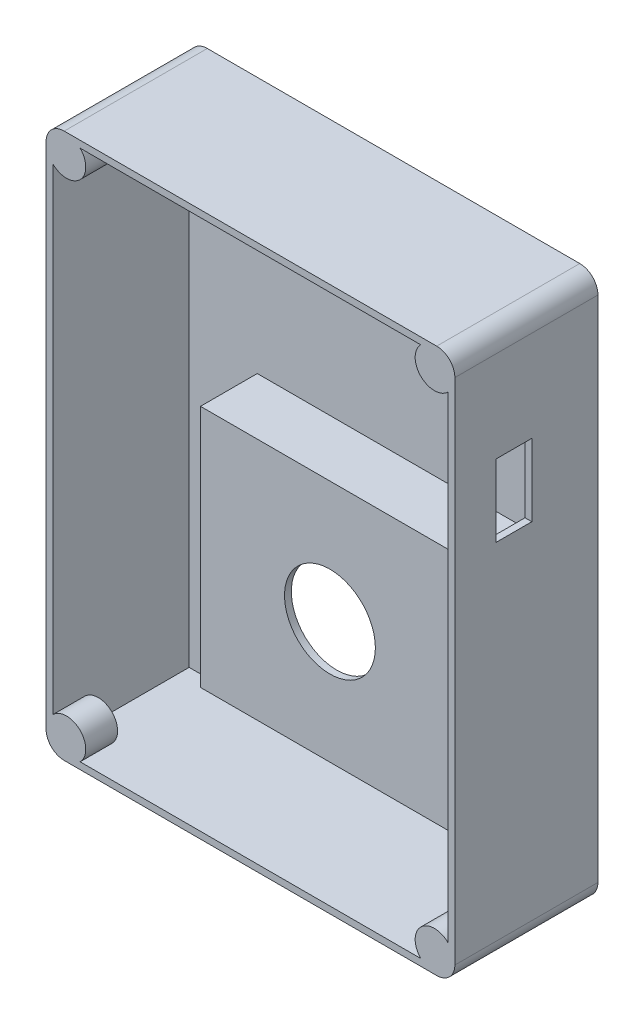
from build123d import *

# Parameters (mm, degrees)
SKETCH2_W               = 90
SKETCH2_H               = 120
BOSS_EXTRUDE1_DEPTH     = 31.5
SKETCH4_W               = 87
SKETCH4_H               = 117
CUT_EXTRUDE1_DEPTH      = 30
FILLET4_R               = 4
SKETCH18_W              = 57
SKETCH18_H              = 53.6
KHAY_PIN_DEPTH          = 12.5
SKETCH21_W              = 53
SKETCH21_H              = 49.6
BOSS_EXTRUDE11_DEPTH    = 15
SKETCH22_W              = 53
SKETCH22_H              = 49.6
CUT_EXTRUDE4_DEPTH      = 13.5
SKETCH30_W              = 7
SKETCH30_H              = 14
CUT_EXTRUDE8_DEPTH      = 5
SKETCH34_R              = 4.242640687
BOSS_EXTRUDE12_DEPTH    = 7
SKETCH37_W              = 7.9
SKETCH37_H              = 15.9
CUT_EXTRUDE10_DEPTH     = 5
MIRROR2_COPY_1_SKETCH_R = 4.242640687
MIRROR2_COPY_1_DEPTH    = 7
SKETCH38_R              = 10
CUT_EXTRUDE11_DEPTH     = 10


with BuildPart() as part:
    # Sketch2 → Boss-Extrude1 (new body)
    with BuildSketch(Plane.XY):
        Rectangle(SKETCH2_W, SKETCH2_H)
    extrude(amount=BOSS_EXTRUDE1_DEPTH)

    # Sketch4 → Cut-Extrude1 (cut)
    with BuildSketch(Plane.XY.offset(31.5)):
        Rectangle(SKETCH4_W, SKETCH4_H)
    extrude(amount=-CUT_EXTRUDE1_DEPTH, mode=Mode.SUBTRACT)

    # Fillet4
    fillet4_edges = [part.edges().sort_by_distance(p)[0] for p in [
        (45, -60, 15.75),
        (-45, -60, 15.75),
        (-45, 60, 15.75),
        (45, 60, 15.75),
    ]]
    fillet(fillet4_edges, radius=FILLET4_R)

    # Sketch18 → khay_pin (add)
    with BuildSketch(Plane.XY.offset(1.5)):
        with Locations((0, -21.775547075)):
            Rectangle(SKETCH18_W, SKETCH18_H)
    extrude(amount=KHAY_PIN_DEPTH)

    # Sketch21 → Boss-Extrude11 (add)
    with BuildSketch(Plane.XY.offset(14)):
        with Locations((0, -21.775547075)):
            Rectangle(SKETCH21_W, SKETCH21_H)
    extrude(amount=-BOSS_EXTRUDE11_DEPTH)

    # Sketch22 → Cut-Extrude4 (cut)
    with BuildSketch(Plane(origin=(0, 0, -1), x_dir=(-1, 0, 0), z_dir=(0, 0, -1))):
        with Locations((0, -21.775547075)):
            Rectangle(SKETCH22_W, SKETCH22_H)
    extrude(amount=-CUT_EXTRUDE4_DEPTH, mode=Mode.SUBTRACT)

    # Sketch30 → Cut-Extrude8 (cut)
    with BuildSketch(Plane.ZY.offset(-26.5)):
        with Locations((9, -8.975547075)):
            Rectangle(SKETCH30_W, SKETCH30_H)
    extrude(amount=-CUT_EXTRUDE8_DEPTH, mode=Mode.SUBTRACT)

    # Sketch34 → Boss-Extrude12 (add)
    with BuildSketch(Plane.XY.offset(31.5)):
        with Locations((-40.5, 55.5)):
            Circle(SKETCH34_R)
    boss_extrude12 = extrude(amount=-BOSS_EXTRUDE12_DEPTH)

    # Sketch37 → Cut-Extrude10 (cut)
    with BuildSketch(Plane(origin=(45, 0, 0), x_dir=(0, 0, -1), z_dir=(1, 0, 0))):
        with Locations((-18.5, 28)):
            Rectangle(SKETCH37_W, SKETCH37_H)
    extrude(amount=-CUT_EXTRUDE10_DEPTH, mode=Mode.SUBTRACT)

    # Mirror1: Boss-Extrude12 across plane
    add(boss_extrude12.mirror(Plane(origin=(0, 0, 0), x_dir=(0, 0, 1), z_dir=(1, 0, 0))))

    # Mirror2: Boss-Extrude12 across plane
    add(boss_extrude12.mirror(Plane.ZX))

    # Mirror2 copy 1 sketch → Mirror2 copy 1 (add)
    with BuildSketch(Plane(origin=(0, 0, 31.5), x_dir=(-1, 0, 0), z_dir=(0, 0, 1))):
        with Locations((-40.5, 55.5)):
            Circle(MIRROR2_COPY_1_SKETCH_R)
    extrude(amount=-MIRROR2_COPY_1_DEPTH)

    # Sketch38 → Cut-Extrude11 (cut)
    with BuildSketch(Plane.XY.offset(14)):
        with Locations((0, -21.775547075)):
            Circle(SKETCH38_R)
    extrude(amount=-CUT_EXTRUDE11_DEPTH, mode=Mode.SUBTRACT)


solid = part.part
